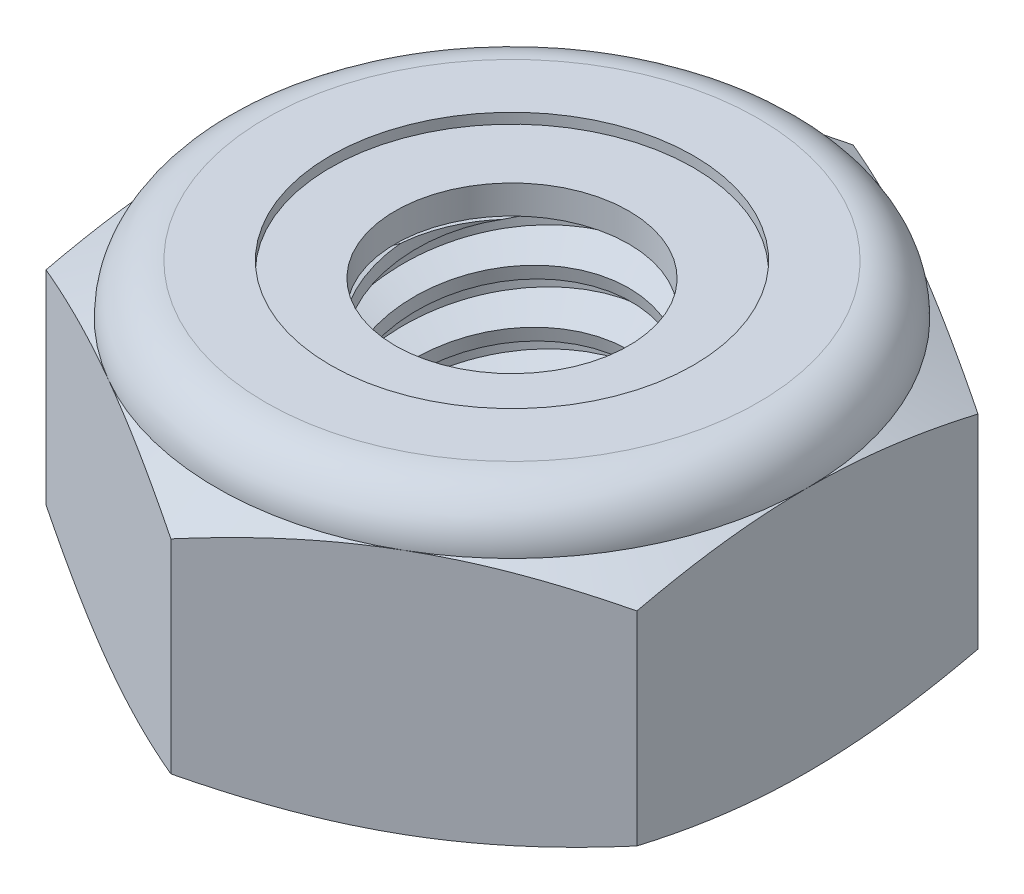
from build123d import *

# Parameters (mm, degrees)
EXTRUDE1_DEPTH       = 4.365625
SKETCH2_W            = 2.0828
SKETCH2_H            = 4.365625
LPATTERN1_COUNT      = 6
LPATTERN1_PITCH      = 0.79375
LPATTERN1_COUNT_DIR2 = 2
LPATTERN1_PITCH_DIR2 = 0.79375


with BuildPart() as part:
    # Sketch1 → Extrude1 (new body)
    with BuildSketch(Plane(origin=(0, 0, 0), x_dir=(1, 0, 0), z_dir=(0, 1, 0))):
        Polygon((0, 5.040989538), (-4.365625, 2.520494769), (-4.365625, -2.520494769), (0, -5.040989538), (4.365625, -2.520494769), (4.365625, 2.520494769), align=None)
    extrude(amount=EXTRUDE1_DEPTH)

    # Sketch4 → Cut-Revolve2 (revolve, cut)
    with BuildSketch(Plane(origin=(0, 0, 0), x_dir=(0, 0, -1), z_dir=(1, 0, 0))):
        Polygon((0, 4.365625), (2.0828, 4.365625), (1.725765218, 4.199136947), (1.725765218, 0.166488053), (2.0828, 0), (0, 0), align=None)
    revolve(axis=Axis((0, 4.365625, 0), (0, 1, 0)), mode=Mode.SUBTRACT)


with BuildPart() as body_2:
    # Sketch2 → Revolve1 (revolve)
    with BuildSketch(Plane(origin=(0, 0, 0), x_dir=(0, 0, -1), z_dir=(1, 0, 0))):
        with Locations((1.0414, 2.1828125)):
            Rectangle(SKETCH2_W, SKETCH2_H)
    revolve(axis=Axis((0, -2.0828, 0), (0, 1, 0)))

    # Sketch3 → Cut-Revolve1 (revolve, cut)
    with BuildSketch(Plane(origin=(0, 0, 0), x_dir=(0, 0, -1), z_dir=(1, 0, 0))):
        Polygon((2.101371857, 4.268159896), (2.231374854, 3.585904168), (1.762908932, 3.74914843), (1.725765218, 3.944078638), align=None)
    cut_revolve1 = revolve(axis=Axis((0, 4.365625, 0.162231854), (0, -0.9823254572523519, -0.18718091792156008)), mode=Mode.SUBTRACT)

    # LPattern1: Cut-Revolve1 6 × 2
    with Locations(*[Vector(0, -1, 0) * (i * LPATTERN1_PITCH) + Vector(0, 1, 0) * (j * LPATTERN1_PITCH_DIR2) for i in range(LPATTERN1_COUNT) for j in range(LPATTERN1_COUNT_DIR2) if (i, j) != (0, 0)]):
        add(cut_revolve1, mode=Mode.SUBTRACT)


with BuildPart() as part_1:
    add(part.part)

    # Combine1: cut body 2
    add(body_2.part, mode=Mode.SUBTRACT)

    # Sketch5 → Cut-Revolve3 (revolve, cut)
    with BuildSketch(Plane(origin=(0, 0, 0), x_dir=(0, 0, -1), z_dir=(1, 0, 0))):
        with BuildLine():
            Line((0, 0), (4.365625, 0))
            Line((4.365625, 0), (5.040989538, 0.314927656))
            Line((5.040989538, 0.314927656), (5.040989538, 3.323093177))
            Line((5.040989538, 3.323093177), (4.365625, 3.638020833))
            ThreePointArc((4.365625, 3.638020833), (4.152514674, 4.152514674), (3.638020833, 4.365625))
            Line((3.638020833, 4.365625), (3.638020833, 5.635625))
            Line((3.638020833, 5.635625), (6.310989538, 5.635625))
            Line((6.310989538, 5.635625), (6.310989538, -1.27))
            Line((6.310989538, -1.27), (0, -1.27))
            Line((0, -1.27), (0, 0))
        make_face()
    revolve(axis=Axis((0, 0, 0), (0, 1, 0)), mode=Mode.SUBTRACT)

    # Sketch6 → Cut-Revolve4 (revolve, cut)
    with BuildSketch(Plane(origin=(0, 0, 0), x_dir=(0, 0, -1), z_dir=(1, 0, 0))):
        with BuildLine():
            Line((0, 3.638020833), (4.213225, 3.638020833))
            ThreePointArc((4.213225, 3.638020833), (4.0447516, 4.0447516), (3.638020833, 4.213225))
            Line((3.638020833, 4.213225), (2.681893026, 4.213225))
            Line((2.681893026, 4.213225), (2.681893026, 5.635625))
            Line((2.681893026, 5.635625), (0, 5.635625))
            Line((0, 5.635625), (0, 3.638020833))
        make_face()
    revolve(axis=Axis((0, 5.635625, 0), (0, 1, 0)), mode=Mode.SUBTRACT)


with BuildPart() as body_2_2:
    # Sketch7 → Revolve2 (revolve)
    with BuildSketch(Plane(origin=(0, 0, 0), x_dir=(0, 0, -1), z_dir=(1, 0, 0))):
        with BuildLine():
            Line((1.725765218, 3.714220833), (4.131172654, 3.714220833))
            ThreePointArc((4.131172654, 3.714220833), (3.962813876, 4.016854092), (3.638020833, 4.137025))
            Line((3.638020833, 4.137025), (1.725765218, 4.137025))
            Line((1.725765218, 4.137025), (1.725765218, 3.714220833))
        make_face()
    revolve(axis=Axis((0, 3.714220833, 0), (0, 1, 0)))


solid = Compound([part_1.part, body_2_2.part])
